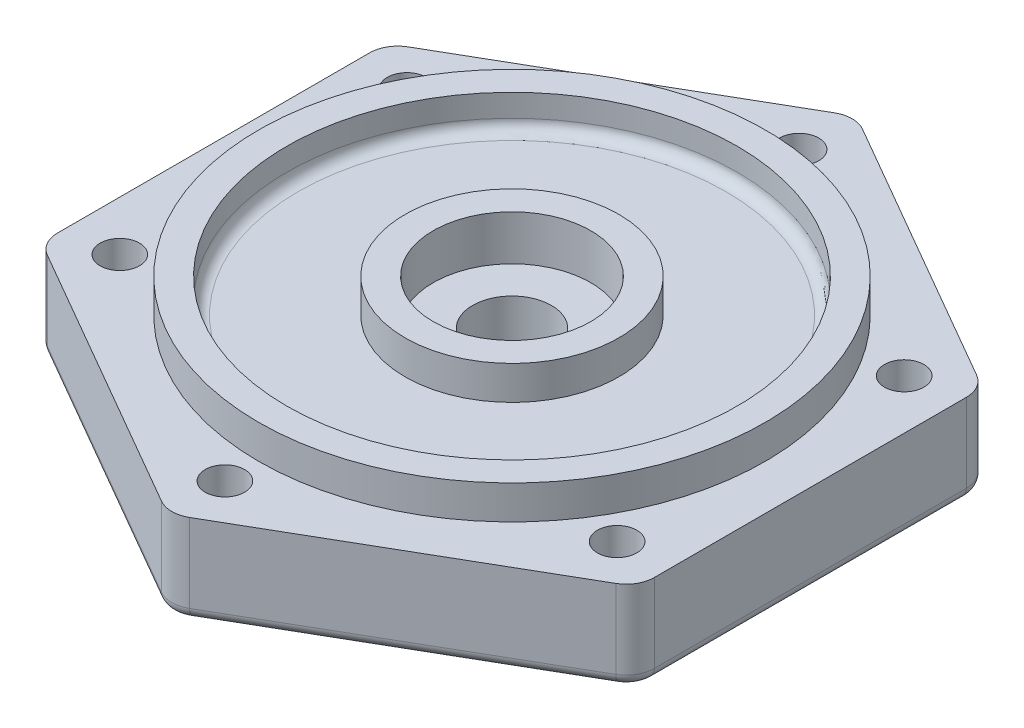
from build123d import *

# Parameters (mm, degrees)
SKETCH1_R           = 7
SKETCH1_R_2         = 3.5
BOSS_EXTRUDE1_DEPTH = 16
SKETCH2_R           = 45
SKETCH2_R_2         = 40
SKETCH2_R_3         = 19
SKETCH2_R_4         = 7
BOSS_EXTRUDE2_DEPTH = 6
SKETCH3_R           = 14
CUT_EXTRUDE1_DEPTH  = 8
BOSS_EXTRUDE3_START = 4
SKETCH4_R           = 23
SKETCH4_R_2         = 7
BOSS_EXTRUDE3_DEPTH = 4
FILLET1_R           = 2


with BuildPart() as part:
    # Sketch1 → Boss-Extrude1 (new body)
    with BuildSketch(Plane(origin=(0, 0, 0), x_dir=(1, 0, 0), z_dir=(0, 1, 0))):
        with BuildLine():
            Line((-2.5, 59.755752861), (-50.5, 32.04293994))
            ThreePointArc((-50.5, 32.04293994), (-52.330127019, 30.212812921), (-53, 27.712812921))
            Line((-53, 27.712812921), (-53, -27.712812921))
            ThreePointArc((-53, -27.712812921), (-52.330127019, -30.212812921), (-50.5, -32.04293994))
            Line((-50.5, -32.04293994), (-2.5, -59.755752861))
            ThreePointArc((-2.5, -59.755752861), (0, -60.425625842), (2.5, -59.755752861))
            Line((2.5, -59.755752861), (50.5, -32.04293994))
            ThreePointArc((50.5, -32.04293994), (52.330127019, -30.212812921), (53, -27.712812921))
            Line((53, -27.712812921), (53, 27.712812921))
            ThreePointArc((53, 27.712812921), (52.330127019, 30.212812921), (50.5, 32.04293994))
            Line((50.5, 32.04293994), (2.5, 59.755752861))
            ThreePointArc((2.5, 59.755752861), (0, 60.425625842), (-2.5, 59.755752861))
        make_face()
        with Locations(Location((0, 0, 0), (0, 0, 270))):
            Circle(SKETCH1_R, mode=Mode.SUBTRACT)
        with Locations(Location((0, 51, 0), (0, 0, 270))):
            Circle(SKETCH1_R_2, mode=Mode.SUBTRACT)
        with Locations(Location((44.167295593, 25.5, 0), (0, 0, 270))):
            Circle(SKETCH1_R_2, mode=Mode.SUBTRACT)
        with Locations(Location((44.167295593, -25.5, 0), (0, 0, 270))):
            Circle(SKETCH1_R_2, mode=Mode.SUBTRACT)
        with Locations(Location((0, -51, 0), (0, 0, 270))):
            Circle(SKETCH1_R_2, mode=Mode.SUBTRACT)
        with Locations(Location((-44.167295593, -25.5, 0), (0, 0, 270))):
            Circle(SKETCH1_R_2, mode=Mode.SUBTRACT)
        with Locations(Location((-44.167295593, 25.5, 0), (0, 0, 270))):
            Circle(SKETCH1_R_2, mode=Mode.SUBTRACT)
    extrude(amount=BOSS_EXTRUDE1_DEPTH)

    # Sketch2 → Boss-Extrude2 (add)
    # profile 1 of 3: a face of its own
    with BuildSketch(Plane(origin=(0, 16, 0), x_dir=(1, 0, 0), z_dir=(0, 1, 0))):
        with Locations(Location((0, 0, 0), (0, 0, 270))):
            Circle(SKETCH2_R)
        with Locations(Location((0, 0, 0), (0, 0, 270))):
            Circle(SKETCH2_R_2, mode=Mode.SUBTRACT)
    # profile 2 of 3: a face of its own
    with BuildSketch(Plane(origin=(0, 16, 0), x_dir=(1, 0, 0), z_dir=(0, 1, 0))):
        with Locations(Location((0, 0, 0), (0, 0, 270))):
            Circle(SKETCH2_R_3)
        with Locations(Location((0, 0, 0), (0, 0, 270))):
            Circle(SKETCH2_R_4, mode=Mode.SUBTRACT)
    # profile 3 of 3: a face of its own
    with BuildSketch(Plane(origin=(0, 16, 0), x_dir=(1, 0, 0), z_dir=(0, 1, 0))):
        with Locations(Location((0, 0, 0), (0, 0, 270))):
            Circle(SKETCH2_R_4)
    extrude(amount=BOSS_EXTRUDE2_DEPTH)

    # Sketch3 → Cut-Extrude1 (cut)
    with BuildSketch(Plane(origin=(0, 22, 0), x_dir=(1, 0, 0), z_dir=(0, 1, 0))):
        with Locations(Location((0, 0, 0), (0, 0, 270))):
            Circle(SKETCH3_R)
    extrude(amount=-CUT_EXTRUDE1_DEPTH, mode=Mode.SUBTRACT)

    # Sketch4 → Boss-Extrude3 (add)
    with BuildSketch(Plane.XZ.offset(BOSS_EXTRUDE3_START)):
        with Locations(Location((0, 0, 0), (0, 0, 90))):
            Circle(SKETCH4_R)
        with Locations(Location((0, 0, 0), (0, 0, 270))):
            Circle(SKETCH4_R_2, mode=Mode.SUBTRACT)
    extrude(amount=-BOSS_EXTRUDE3_DEPTH)

    # Fillet1
    fillet1_edges = [part.edges().sort_by_distance(p)[0] for p in [
        (26.5, 0, 45.899346401),
        (0, 0, 60.425625842),
        (-26.5, 0, 45.899346401),
        (-52.330127019, 0, 30.212812921),
        (-53, 0, 0),
        (-52.330127019, 0, -30.212812921),
        (-26.5, 0, -45.899346401),
        (0, 0, -60.425625842),
        (26.5, 0, -45.899346401),
        (52.330127019, 0, -30.212812921),
        (53, 0, 0),
        (52.330127019, 0, 30.212812921),
        (0, 16, -40),
        (0, 0, -23),
    ]]
    fillet(fillet1_edges, radius=FILLET1_R)


solid = part.part
